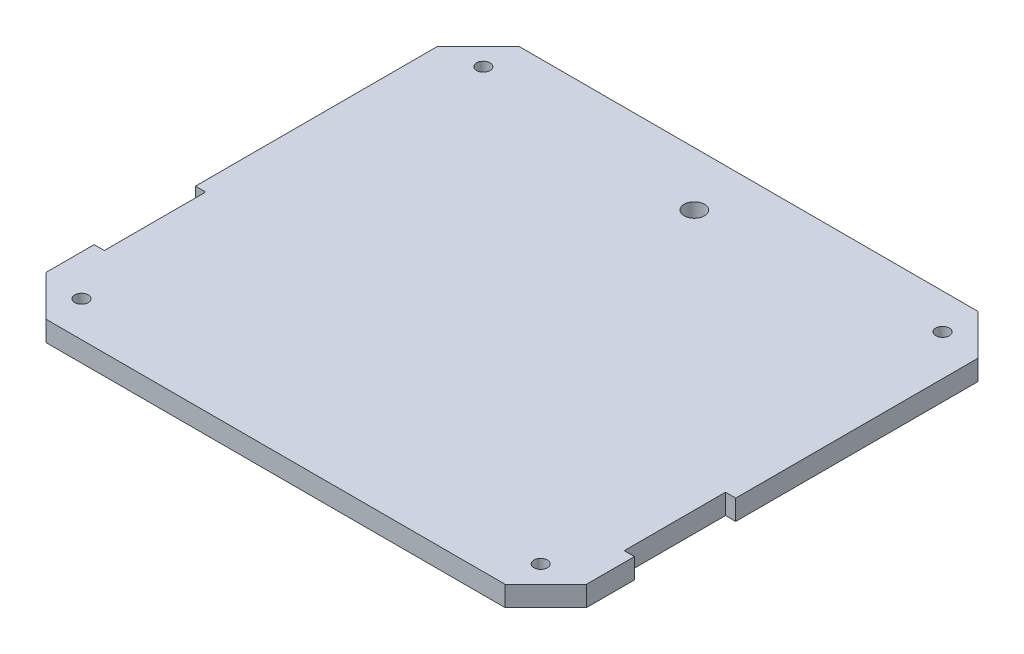
from build123d import *

# Parameters (mm, degrees)
BOSS_EXTRUDE1_DEPTH = 15
SKETCH4_R           = 5
CUT_EXTRUDE1_DEPTH  = 267.176633084
SKETCH5_R           = 7.5
CUT_EXTRUDE2_DEPTH  = 267.176633084


with BuildPart() as part:
    # Sketch1 → Boss-Extrude1 (new body)
    with BuildSketch(Plane(origin=(0, 0, 0), x_dir=(1, 0, 0), z_dir=(0, 1, 0))):
        Polygon((-200, -175), (200, -175), (200, -109.36837475), (192.446978441, -109.36837475), (192.446978441, -34.36837475), (200, -34.36837475), (200, 175), (-200, 175), (-200, -34.36837475), (-192.446978441, -34.36837475), (-192.446978441, -109.36837475), (-200, -109.36837475), align=None)
    extrude(amount=BOSS_EXTRUDE1_DEPTH)

    # Sketch4 → Cut-Extrude1 (cut, through all)
    with BuildSketch(Plane(origin=(0, 15, 0), x_dir=(1, 0, 0), z_dir=(0, 1, 0))):
        with Locations(Location((-170, 148.75, 0), (0, 0, 270))):
            Circle(SKETCH4_R)
        with Locations(Location((170, 148.75, 0), (0, 0, 90))):
            Circle(SKETCH4_R)
        with Locations(Location((170, -148.75, 0), (0, 0, 270))):
            Circle(SKETCH4_R)
        with Locations(Location((-170, -148.75, 0), (0, 0, 90))):
            Circle(SKETCH4_R)
        Polygon((-170, 175), (-200, 145), (-200, 175), align=None)
        Polygon((-200, -145), (-200, -175), (-170, -175), align=None)
        Polygon((170, -175), (200, -145), (200, -175), align=None)
        Polygon((200, 145), (200, 175), (170, 175), align=None)
    extrude(amount=-CUT_EXTRUDE1_DEPTH, mode=Mode.SUBTRACT)

    # Sketch5 → Cut-Extrude2 (cut, through all)
    with BuildSketch(Plane.XZ):
        with Locations(Location((0, -135, 0), (0, 0, 270))):
            Circle(SKETCH5_R)
    extrude(amount=-CUT_EXTRUDE2_DEPTH, mode=Mode.SUBTRACT)


solid = part.part
